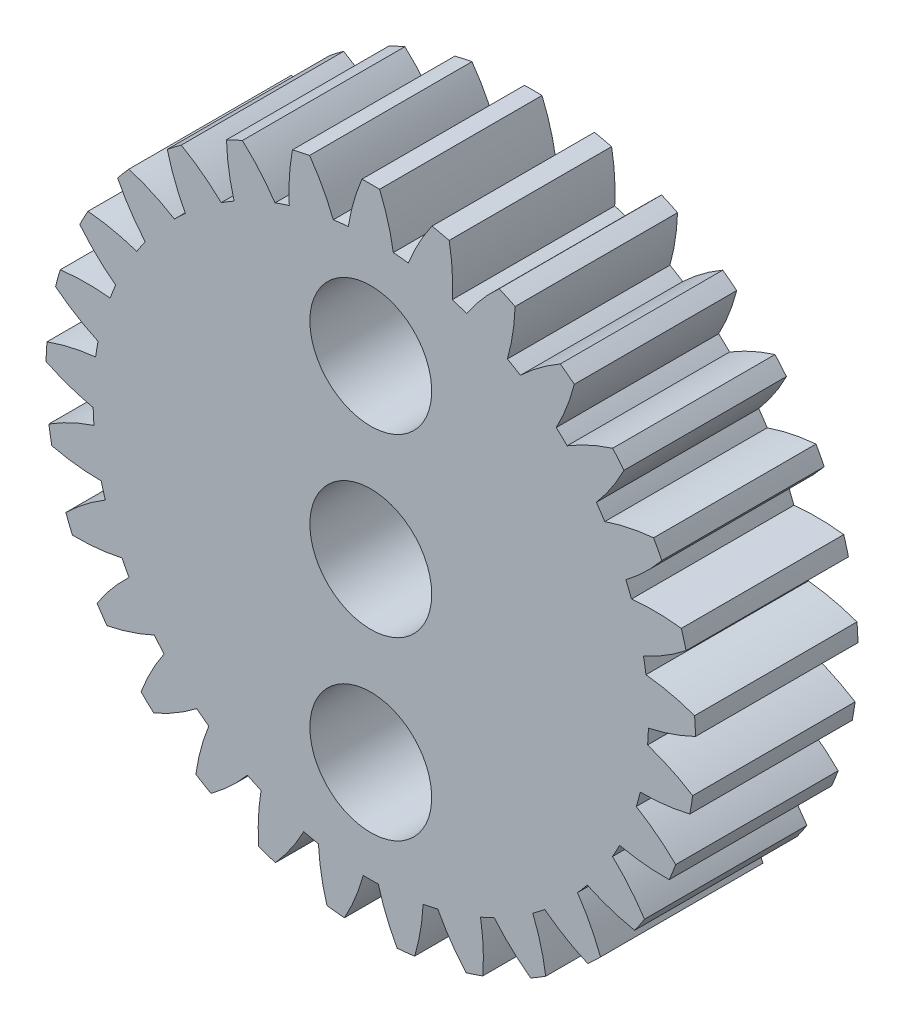
from build123d import *

# Parameters (mm, degrees)
SALIENTE_EXTRUIR1_DEPTH      = 3
TALADRO_DE_MARGEN_PARA_M41_D = 4.5
CROQUIS5_R                   = 2.25
CORTAR_EXTRUIR1_DEPTH        = 18.996470298


with BuildPart() as part:
    # Croquis1 → Saliente-Extruir1 (new, symmetric)
    with BuildSketch(Plane.XY):
        with BuildLine():
            ThreePointArc((-2.895946743, 11.644859691), (-3.009117478, 10.728998645), (-3.010959692, 9.806173809))
            ThreePointArc((-3.010959692, 9.806173809), (-3.275400684, 9.721042814), (-3.537439407, 9.628782139))
            ThreePointArc((-3.537439407, 9.628782139), (-4.097375777, 10.362321731), (-4.741725704, 11.022944348))
            ThreePointArc((-4.741725704, 11.022944348), (-5.038481398, 10.890499068), (-5.331541731, 10.750066396))
            ThreePointArc((-5.331541731, 10.750066396), (-5.245183545, 9.83128931), (-5.048602628, 8.929643584))
            ThreePointArc((-5.048602628, 8.929643584), (-5.288560489, 8.789655908), (-5.524639575, 8.643221656))
            ThreePointArc((-5.524639575, 8.643221656), (-6.229174272, 9.239241733), (-7.000473991, 9.745903173))
            ThreePointArc((-7.000473991, 9.745903173), (-7.261819882, 9.552760688), (-7.517839754, 9.352611945))
            ThreePointArc((-7.517839754, 9.352611945), (-7.235990659, 8.473879813), (-6.850178516, 7.63557315))
            ThreePointArc((-6.850178516, 7.63557315), (-7.054433084, 7.447274461), (-7.253513736, 7.253513736))
            ThreePointArc((-7.253513736, 7.253513736), (-8.069703502, 7.68414506), (-8.931887895, 8.013154397))
            ThreePointArc((-8.931887895, 8.013154397), (-9.145603739, 7.768345835), (-9.352611945, 7.517839754))
            ThreePointArc((-9.352611945, 7.517839754), (-8.888450892, 6.720241115), (-8.33144767, 5.984471802))
            ThreePointArc((-8.33144767, 5.984471802), (-8.490448228, 5.756666737), (-8.643221656, 5.524639575))
            ThreePointArc((-8.643221656, 5.524639575), (-9.532902364, 5.769746305), (-10.445656648, 5.905719428))
            ThreePointArc((-10.445656648, 5.905719428), (-10.60174933, 5.620691765), (-10.750066396, 5.331541731))
            ThreePointArc((-10.750066396, 5.331541731), (-10.125297041, 4.652371411), (-9.423147591, 4.053543204))
            ThreePointArc((-9.423147591, 4.053543204), (-9.529459449, 3.796883675), (-9.628782139, 3.537439407))
            ThreePointArc((-9.628782139, 3.537439407), (-10.550353308, 3.585560625), (-11.470998105, 3.522139582))
            ThreePointArc((-11.470998105, 3.522139582), (-11.562168905, 3.210220394), (-11.644859691, 2.895946743))
            ThreePointArc((-11.644859691, 2.895946743), (-10.888695553, 2.366961991), (-10.074231604, 1.93307543))
            ThreePointArc((-10.074231604, 1.93307543), (-10.122883738, 1.659562552), (-10.16411147, 1.384832505))
            ThreePointArc((-10.16411147, 1.384832505), (-11.074481456, 1.233718115), (-11.95996844, 0.973868403))
            ThreePointArc((-11.95996844, 0.973868403), (-11.981954312, 0.649642686), (-11.995152289, 0.324940503))
            ThreePointArc((-11.995152289, 0.324940503), (-11.142950763, -0.029123942), (-10.254255744, -0.277780802))
            ThreePointArc((-10.254255744, -0.277780802), (-10.242973234, -0.555357872), (-10.224178245, -0.832527627))
            ThreePointArc((-10.224178245, -0.832527627), (-11.08077916, -1.175811683), (-11.889703944, -1.619939779))
            ThreePointArc((-11.889703944, -1.619939779), (-11.841476853, -1.941311592), (-11.784564897, -2.261259593))
            ThreePointArc((-11.784564897, -2.261259593), (-10.87617398, -2.423848071), (-9.954802282, -2.475648312))
            ThreePointArc((-9.954802282, -2.475648312), (-9.884112685, -2.744310378), (-9.806173809, -3.010959692))
            ThreePointArc((-9.806173809, -3.010959692), (-10.568951946, -3.530361833), (-11.263490105, -4.138001378))
            ThreePointArc((-11.263490105, -4.138001378), (-11.147305097, -4.441492298), (-11.022944348, -4.741725704))
            ThreePointArc((-11.022944348, -4.741725704), (-10.100839389, -4.705235758), (-9.189873329, -4.557757259))
            ThreePointArc((-9.189873329, -4.557757259), (-9.063082013, -4.804941982), (-8.929643584, -5.048602628))
            ThreePointArc((-8.929643584, -5.048602628), (-9.562932285, -5.719836188), (-10.110607988, -6.462574632))
            ThreePointArc((-10.110607988, -6.462574632), (-9.931897744, -6.73399376), (-9.745903173, -7.000473991))
            ThreePointArc((-9.745903173, -7.000473991), (-8.853200775, -6.766611851), (-7.995236113, -6.426750542))
            ThreePointArc((-7.995236113, -6.426750542), (-7.818271699, -6.640899839), (-7.63557315, -6.850178516))
            ThreePointArc((-7.63557315, -6.850178516), (-8.10976054, -7.641857359), (-8.484965078, -8.484965078))
            ThreePointArc((-8.484965078, -8.484965078), (-8.252085891, -8.711621158), (-8.013154397, -8.931887895))
            ThreePointArc((-8.013154397, -8.931887895), (-7.191596333, -8.511588694), (-6.426750542, -7.995236113))
            ThreePointArc((-6.426750542, -7.995236113), (-6.20788769, -8.1663366), (-5.984471802, -8.33144767))
            ThreePointArc((-5.984471802, -8.33144767), (-6.277385404, -9.206553774), (-6.462574632, -10.110607988))
            ThreePointArc((-6.462574632, -10.110607988), (-6.186415674, -10.281902833), (-5.905719428, -10.445656648))
            ThreePointArc((-5.905719428, -10.445656648), (-5.193720838, -9.85857311), (-4.557757259, -9.189873329))
            ThreePointArc((-4.557757259, -9.189873329), (-4.307229752, -9.309924538), (-4.053543204, -9.423147591))
            ThreePointArc((-4.053543204, -9.423147591), (-4.151486704, -10.340761967), (-4.138001378, -11.263490105))
            ThreePointArc((-4.138001378, -11.263490105), (-3.831475535, -11.371414159), (-3.522139582, -11.470998105))
            ThreePointArc((-3.522139582, -11.470998105), (-2.95299273, -10.744581604), (-2.475648312, -9.954802282))
            ThreePointArc((-2.475648312, -9.954802282), (-2.205170538, -10.018190751), (-1.93307543, -10.074231604))
            ThreePointArc((-1.93307543, -10.074231604), (-1.8314691, -10.991447623), (-1.619939779, -11.889703944))
            ThreePointArc((-1.619939779, -11.889703944), (-1.297379858, -11.929210798), (-0.973868403, -11.95996844))
            ThreePointArc((-0.973868403, -11.95996844), (-0.574185964, -11.128185404), (-0.277780802, -10.254255744))
            ThreePointArc((-0.277780802, -10.254255744), (0, -10.2580175), (0.277780802, -10.254255744))
            ThreePointArc((0.277780802, -10.254255744), (0.574185964, -11.128185404), (0.973868403, -11.95996844))
            ThreePointArc((0.973868403, -11.95996844), (1.297379858, -11.929210798), (1.619939779, -11.889703944))
            ThreePointArc((1.619939779, -11.889703944), (1.8314691, -10.991447623), (1.93307543, -10.074231604))
            ThreePointArc((1.93307543, -10.074231604), (2.205170538, -10.018190751), (2.475648312, -9.954802282))
            ThreePointArc((2.475648312, -9.954802282), (2.95299273, -10.744581604), (3.522139582, -11.470998105))
            ThreePointArc((3.522139582, -11.470998105), (3.831475535, -11.371414159), (4.138001378, -11.263490105))
            ThreePointArc((4.138001378, -11.263490105), (4.151486704, -10.340761967), (4.053543204, -9.423147591))
            ThreePointArc((4.053543204, -9.423147591), (4.307229752, -9.309924538), (4.557757259, -9.189873329))
            ThreePointArc((4.557757259, -9.189873329), (5.193720838, -9.85857311), (5.905719428, -10.445656648))
            ThreePointArc((5.905719428, -10.445656648), (6.186415674, -10.281902833), (6.462574632, -10.110607988))
            ThreePointArc((6.462574632, -10.110607988), (6.277385404, -9.206553774), (5.984471802, -8.33144767))
            ThreePointArc((5.984471802, -8.33144767), (6.20788769, -8.1663366), (6.426750542, -7.995236113))
            ThreePointArc((6.426750542, -7.995236113), (7.191596333, -8.511588694), (8.013154397, -8.931887895))
            ThreePointArc((8.013154397, -8.931887895), (8.252085891, -8.711621158), (8.484965078, -8.484965078))
            ThreePointArc((8.484965078, -8.484965078), (8.10976054, -7.641857359), (7.63557315, -6.850178516))
            ThreePointArc((7.63557315, -6.850178516), (7.818271699, -6.640899839), (7.995236113, -6.426750542))
            ThreePointArc((7.995236113, -6.426750542), (8.853200775, -6.766611851), (9.745903173, -7.000473991))
            ThreePointArc((9.745903173, -7.000473991), (9.931897744, -6.73399376), (10.110607988, -6.462574632))
            ThreePointArc((10.110607988, -6.462574632), (9.562932285, -5.719836188), (8.929643584, -5.048602628))
            ThreePointArc((8.929643584, -5.048602628), (9.063082013, -4.804941982), (9.189873329, -4.557757259))
            ThreePointArc((9.189873329, -4.557757259), (10.100839389, -4.705235758), (11.022944348, -4.741725704))
            ThreePointArc((11.022944348, -4.741725704), (11.147305097, -4.441492298), (11.263490105, -4.138001378))
            ThreePointArc((11.263490105, -4.138001378), (10.568951946, -3.530361833), (9.806173809, -3.010959692))
            ThreePointArc((9.806173809, -3.010959692), (9.884112685, -2.744310378), (9.954802282, -2.475648312))
            ThreePointArc((9.954802282, -2.475648312), (10.87617398, -2.423848071), (11.784564897, -2.261259593))
            ThreePointArc((11.784564897, -2.261259593), (11.841476853, -1.941311592), (11.889703944, -1.619939779))
            ThreePointArc((11.889703944, -1.619939779), (11.08077916, -1.175811683), (10.224178245, -0.832527627))
            ThreePointArc((10.224178245, -0.832527627), (10.242973234, -0.555357872), (10.254255744, -0.277780802))
            ThreePointArc((10.254255744, -0.277780802), (11.142950763, -0.029123942), (11.995152289, 0.324940503))
            ThreePointArc((11.995152289, 0.324940503), (11.981954312, 0.649642686), (11.95996844, 0.973868403))
            ThreePointArc((11.95996844, 0.973868403), (11.074481456, 1.233718115), (10.16411147, 1.384832505))
            ThreePointArc((10.16411147, 1.384832505), (10.122883738, 1.659562552), (10.074231604, 1.93307543))
            ThreePointArc((10.074231604, 1.93307543), (10.888695553, 2.366961991), (11.644859691, 2.895946743))
            ThreePointArc((11.644859691, 2.895946743), (11.562168905, 3.210220394), (11.470998105, 3.522139582))
            ThreePointArc((11.470998105, 3.522139582), (10.550353308, 3.585560625), (9.628782139, 3.537439407))
            ThreePointArc((9.628782139, 3.537439407), (9.529459449, 3.796883675), (9.423147591, 4.053543204))
            ThreePointArc((9.423147591, 4.053543204), (10.125297041, 4.652371411), (10.750066396, 5.331541731))
            ThreePointArc((10.750066396, 5.331541731), (10.60174933, 5.620691765), (10.445656648, 5.905719428))
            ThreePointArc((10.445656648, 5.905719428), (9.532902364, 5.769746305), (8.643221656, 5.524639575))
            ThreePointArc((8.643221656, 5.524639575), (8.490448228, 5.756666737), (8.33144767, 5.984471802))
            ThreePointArc((8.33144767, 5.984471802), (8.888450892, 6.720241115), (9.352611945, 7.517839754))
            ThreePointArc((9.352611945, 7.517839754), (9.145603739, 7.768345835), (8.931887895, 8.013154397))
            ThreePointArc((8.931887895, 8.013154397), (8.069703502, 7.68414506), (7.253513736, 7.253513736))
            ThreePointArc((7.253513736, 7.253513736), (7.054433084, 7.447274461), (6.850178516, 7.63557315))
            ThreePointArc((6.850178516, 7.63557315), (7.235990659, 8.473879813), (7.517839754, 9.352611945))
            ThreePointArc((7.517839754, 9.352611945), (7.261819882, 9.552760688), (7.000473991, 9.745903173))
            ThreePointArc((7.000473991, 9.745903173), (6.229174272, 9.239241733), (5.524639575, 8.643221656))
            ThreePointArc((5.524639575, 8.643221656), (5.288560489, 8.789655908), (5.048602628, 8.929643584))
            ThreePointArc((5.048602628, 8.929643584), (5.245183545, 9.83128931), (5.331541731, 10.750066396))
            ThreePointArc((5.331541731, 10.750066396), (5.038481398, 10.890499068), (4.741725704, 11.022944348))
            ThreePointArc((4.741725704, 11.022944348), (4.097375777, 10.362321731), (3.537439407, 9.628782139))
            ThreePointArc((3.537439407, 9.628782139), (3.275400684, 9.721042814), (3.010959692, 9.806173809))
            ThreePointArc((3.010959692, 9.806173809), (3.009117478, 10.728998645), (2.895946743, 11.644859691))
            ThreePointArc((2.895946743, 11.644859691), (2.579549124, 11.719009816), (2.261259593, 11.784564897))
            ThreePointArc((2.261259593, 11.784564897), (1.773988544, 11.000871082), (1.384832505, 10.16411147))
            ThreePointArc((1.384832505, 10.16411147), (1.109086783, 10.197884562), (0.832527627, 10.224178245))
            ThreePointArc((0.832527627, 10.224178245), (0.632348422, 11.125031927), (0.324940503, 11.995152289))
            ThreePointArc((0.324940503, 11.995152289), (0, 11.99955269), (-0.324940503, 11.995152289))
            ThreePointArc((-0.324940503, 11.995152289), (-0.632348422, 11.125031927), (-0.832527627, 10.224178245))
            ThreePointArc((-0.832527627, 10.224178245), (-1.109086783, 10.197884562), (-1.384832505, 10.16411147))
            ThreePointArc((-1.384832505, 10.16411147), (-1.773988544, 11.000871082), (-2.261259593, 11.784564897))
            ThreePointArc((-2.261259593, 11.784564897), (-2.579549124, 11.719009816), (-2.895946743, 11.644859691))
        make_face()
    extrude(amount=SALIENTE_EXTRUIR1_DEPTH, both=True)

    # Taladro de margen para M41 (through all)
    with Locations(Plane.XY.offset(3)):
        with Locations((0, 0)):
            Hole(TALADRO_DE_MARGEN_PARA_M41_D / 2)

    # Croquis5 → Cortar-Extruir1 (cut, through all)
    with BuildSketch(Plane(origin=(0, 0, -3), x_dir=(-1, 0, 0), z_dir=(0, 0, -1))):
        with Locations((0, 6.5)):
            Circle(CROQUIS5_R)
        with Locations((0, -6.5)):
            Circle(CROQUIS5_R)
    extrude(amount=-CORTAR_EXTRUIR1_DEPTH, mode=Mode.SUBTRACT)


solid = part.part
